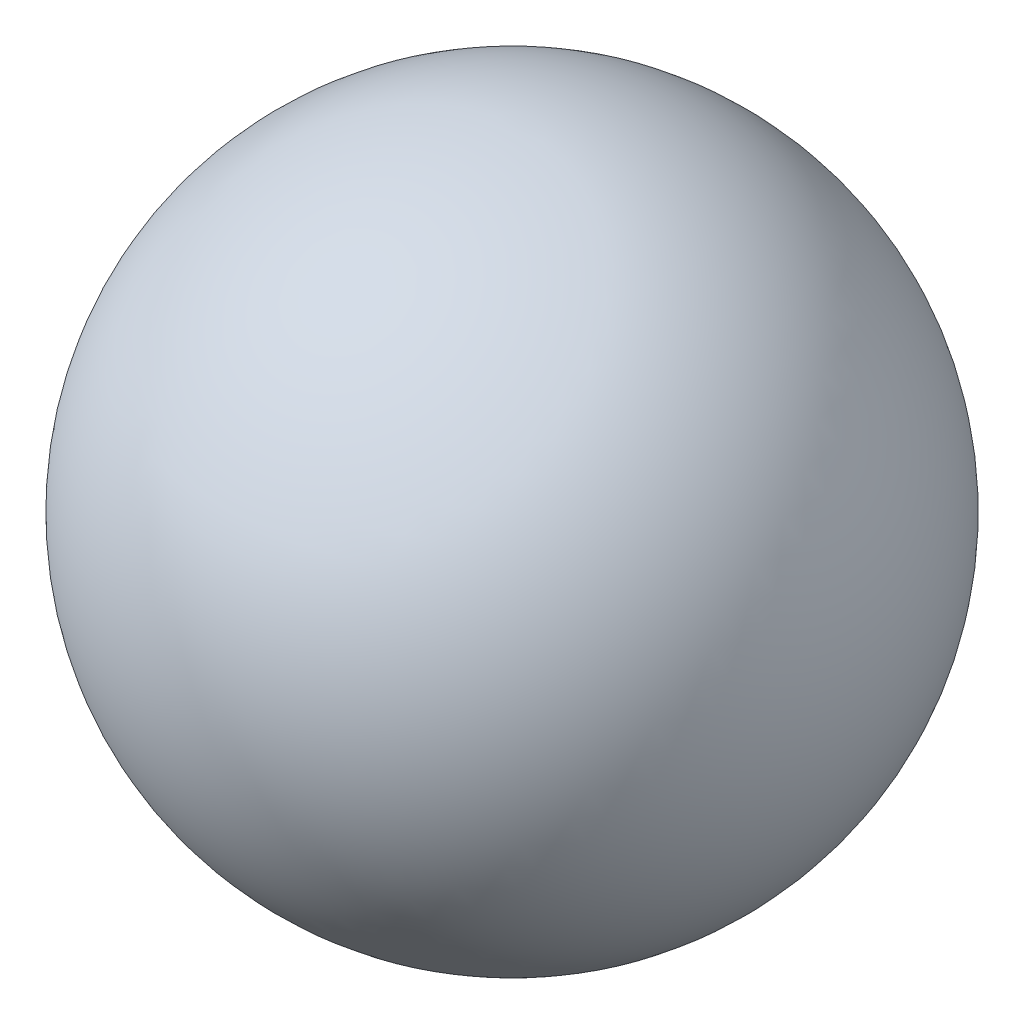
from build123d import *


with BuildPart() as part:
    # Sketch1 → Revolve4 (revolve)
    with BuildSketch(Plane.XY):
        with BuildLine():
            Line((0, 9.525), (0, -9.525))
            ThreePointArc((0, -9.525), (9.525, 0), (0, 9.525))
        make_face()
    revolve(axis=Axis((0, 9.525, 0), (0, -1, 0)))


solid = part.part
